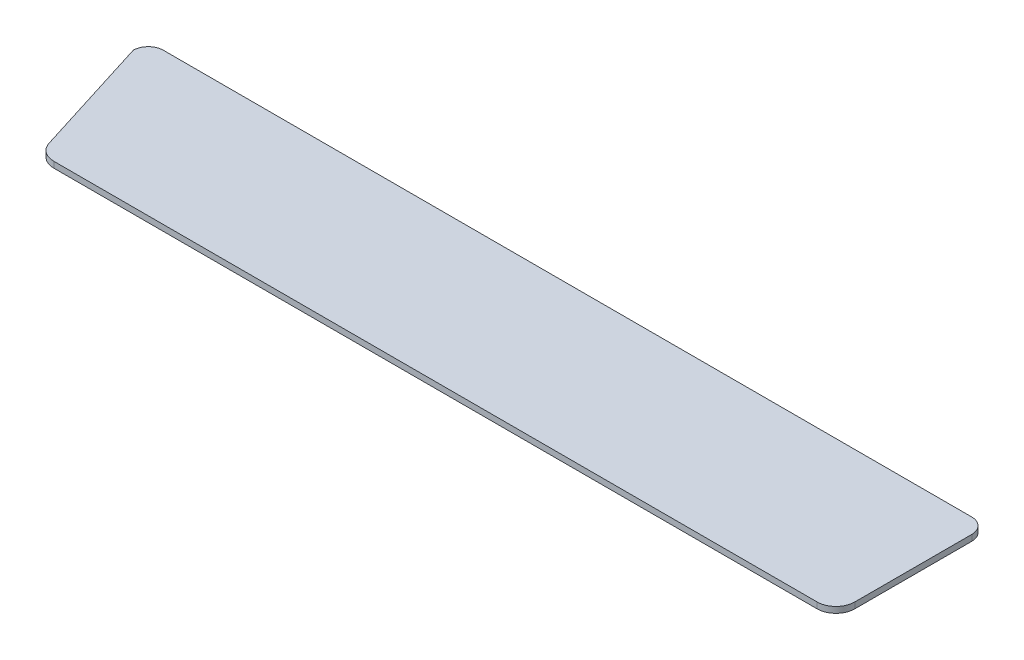
from build123d import *

# Parameters (mm, degrees)
BOSS_EXTRUDE1_DEPTH = 3.175
SKETCH2_W           = 597.466303312
SKETCH2_H           = 60.972543052
CUT_EXTRUDE1_DEPTH  = 70
FILLET1_R           = 10
FILLET2_R           = 10


with BuildPart() as part:
    # Sketch1 → Boss-Extrude1 (new body)
    with BuildSketch(Plane(origin=(0, 0, 0), x_dir=(1, 0, 0), z_dir=(0, 1, 0))):
        with BuildLine():
            ThreePointArc((8, 150), (2.343145751, 147.656854249), (0, 142))
            Line((0, 142), (42, 8))
            ThreePointArc((42, 8), (44.343145751, 2.343145751), (50, 0))
            Line((50, 0), (436.5, 0))
            ThreePointArc((436.5, 0), (442.156854249, 2.343145751), (444.5, 8))
            Line((444.5, 8), (444.5, 142))
            ThreePointArc((444.5, 142), (442.156854249, 147.656854249), (436.5, 150))
            Line((436.5, 150), (8, 150))
        make_face()
    extrude(amount=BOSS_EXTRUDE1_DEPTH)

    # Sketch2 → Cut-Extrude1 (cut)
    with BuildSketch(Plane.XY):
        with Locations((220.1785332, 7.544358636)):
            Rectangle(SKETCH2_W, SKETCH2_H)
    extrude(amount=-CUT_EXTRUDE1_DEPTH, mode=Mode.SUBTRACT)

    # Fillet1
    fillet1_edges = [part.edges().sort_by_distance(p)[0] for p in [
        (22.567164179, 1.5875, -70),
    ]]
    fillet(fillet1_edges, radius=FILLET1_R)

    # Fillet2
    fillet2_edges = [part.edges().sort_by_distance(p)[0] for p in [
        (444.5, 1.5875, -70),
    ]]
    fillet(fillet2_edges, radius=FILLET2_R)


solid = part.part
